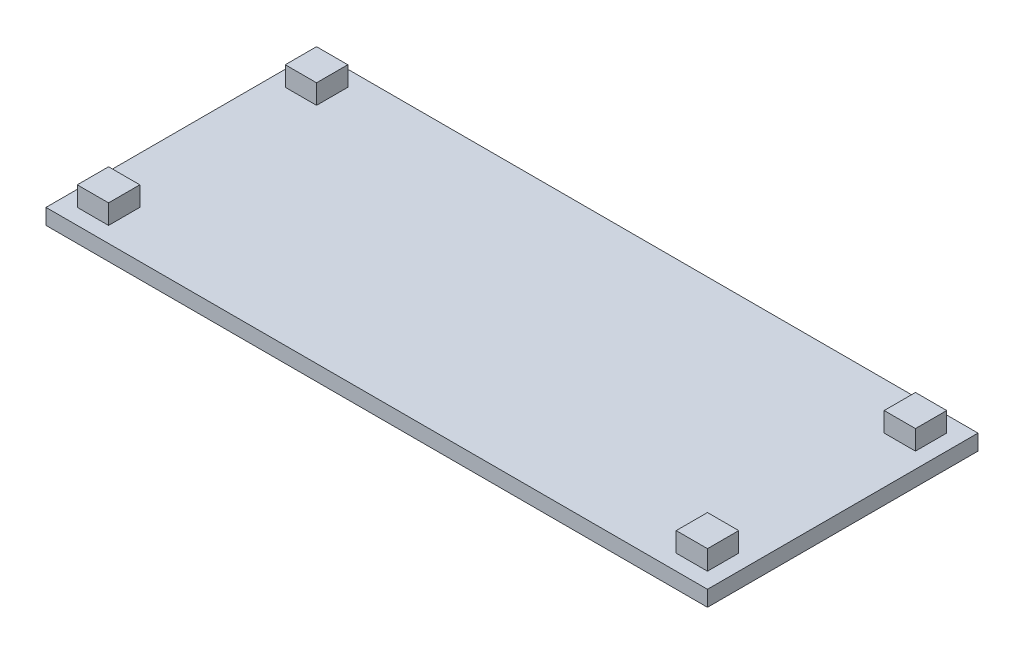
from build123d import *

# Parameters (mm, degrees)
SKETCH_1_W      = 84.6
SKETCH_1_H      = 34.6
EXTRUDE_1_DEPTH = 2
SKETCH_3_W      = 4
SKETCH_3_H      = 4
EXTRUDE_3_DEPTH = 4.5


with BuildPart() as part:
    # 草图1 → 凸台-拉伸1 (new body)
    with BuildSketch(Plane(origin=(0, 0, 0), x_dir=(1, 0, 0), z_dir=(0, 1, 0))):
        Rectangle(SKETCH_1_W, SKETCH_1_H)
    extrude(amount=EXTRUDE_1_DEPTH)

    # 草图3 → 凸台-拉伸3 (add)
    with BuildSketch(Plane(origin=(0, 0, 0), x_dir=(1, 0, 0), z_dir=(0, 1, 0))):
        with Locations((38.3, 13.3)):
            Rectangle(SKETCH_3_W, SKETCH_3_H)
        with Locations((38.3, -13.3)):
            Rectangle(SKETCH_3_W, SKETCH_3_H)
        with Locations((-38.3, 13.3)):
            Rectangle(SKETCH_3_W, SKETCH_3_H)
        with Locations((-38.3, -13.3)):
            Rectangle(SKETCH_3_W, SKETCH_3_H)
    extrude(amount=EXTRUDE_3_DEPTH)


solid = part.part
